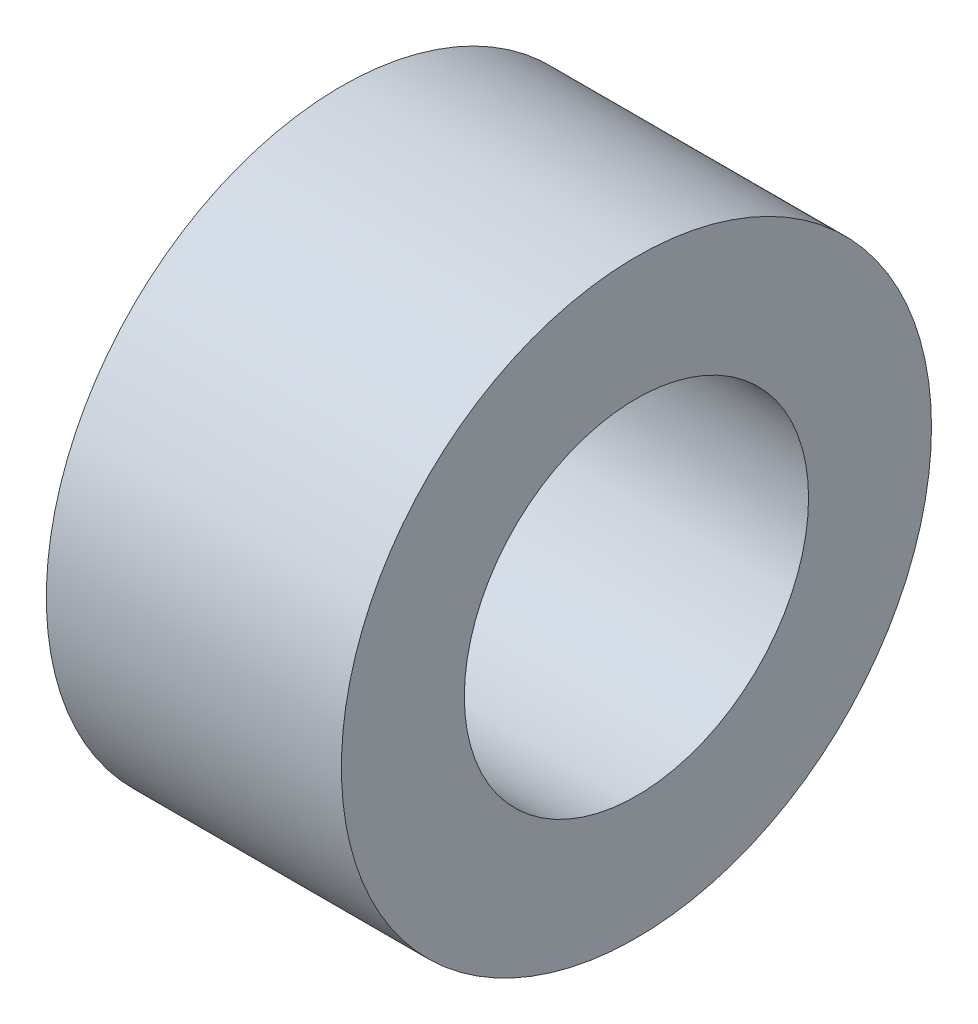
from build123d import *

# Parameters (mm, degrees)
SKETCH1_R           = 6
SKETCH1_R_2         = 3.5
BOSS_EXTRUDE1_DEPTH = 3


with BuildPart() as part:
    # Sketch1 → Boss-Extrude1 (new, symmetric)
    with BuildSketch(Plane(origin=(0, 0, 0), x_dir=(0, 0, -1), z_dir=(1, 0, 0))):
        Circle(SKETCH1_R)
        Circle(SKETCH1_R_2, mode=Mode.SUBTRACT)
    extrude(amount=BOSS_EXTRUDE1_DEPTH, both=True)


solid = part.part
